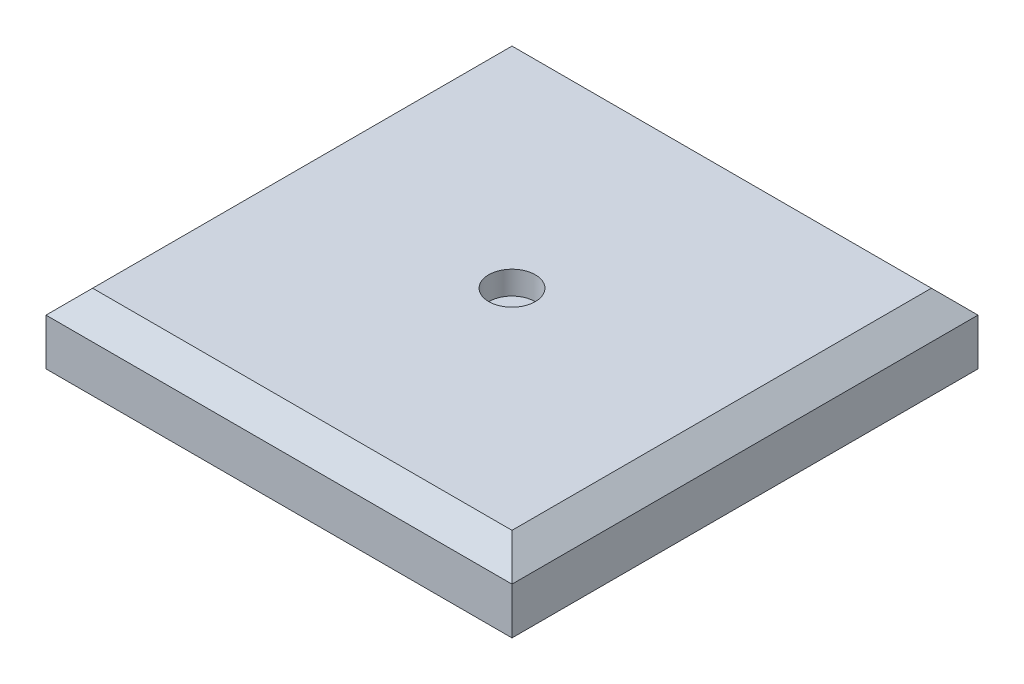
from build123d import *

# Parameters (mm, degrees)
CROQUIS1_W              = 100
CROQUIS1_H              = 100
SALIENTE_EXTRUIR1_DEPTH = 15
CHAFL_N1_SIZE           = 5
CROQUIS3_R              = 5
CORTAR_EXTRUIR1_DEPTH   = 5


with BuildPart() as part:
    # Croquis1 → Saliente-Extruir1 (new body)
    with BuildSketch(Plane(origin=(0, 0, 0), x_dir=(1, 0, 0), z_dir=(0, 1, 0))):
        with Locations((50, 50)):
            Rectangle(CROQUIS1_W, CROQUIS1_H)
    extrude(amount=SALIENTE_EXTRUIR1_DEPTH)

    # Chaflán1
    chafl_n1_edges = [part.edges().sort_by_distance(p)[0] for p in [
        (100, 15, -50),
        (50, 15, -100),
        (0, 15, -50),
        (50, 15, 0),
    ]]
    chamfer(chafl_n1_edges, length=CHAFL_N1_SIZE)

    # Croquis3 → Cortar-Extruir1 (cut)
    with BuildSketch(Plane(origin=(0, 15, 0), x_dir=(1, 0, 0), z_dir=(0, 1, 0))):
        with Locations(Location((50, 50, 0), (0, 0, 270))):
            Circle(CROQUIS3_R)
    extrude(amount=-CORTAR_EXTRUIR1_DEPTH, mode=Mode.SUBTRACT)


solid = part.part
